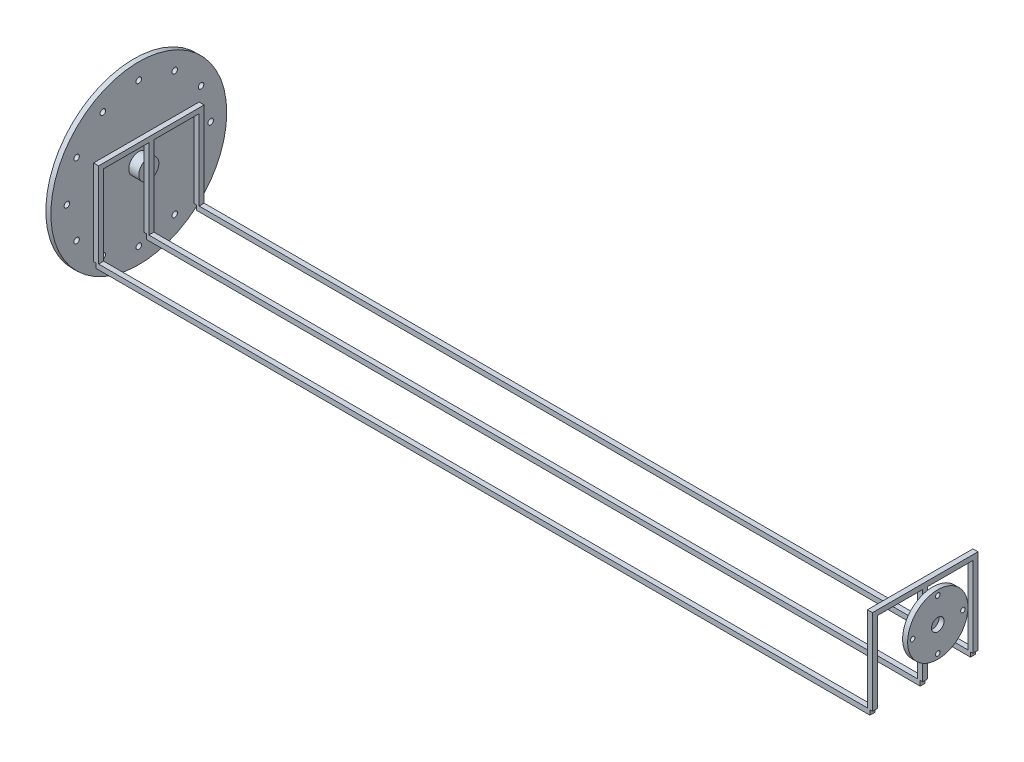
from build123d import *

# Parameters (mm, degrees)
SKETCH_1_R             = 175
SKETCH_1_R_2           = 5.5
EXTRUDE_1_DEPTH        = 10
SKETCH_2_R             = 20
EXTRUDE_2_DEPTH        = 30
EXTRUDE_START          = 20
SKETCH_2_2_R           = 20
EXTRUDE_3_DEPTH        = 20
SKETCH_3_W             = 10
SKETCH_3_H             = 169.24993674
EXTRUDE_1_2_DEPTH      = 10
SKETCH_4_W             = 1540
SKETCH_4_H             = 10
EXTRUDE_2_2_DEPTH      = 10
PATTERN_LINEAR_1_COUNT = 2
PATTERN_LINEAR_1_PITCH = 1540
PATTERN_LINEAR_2_COUNT = 2
PATTERN_LINEAR_2_PITCH = 1560
SKETCH_5_R             = 60
EXTRUDE_4_DEPTH        = 10
CUT_EXTRUDE_2_REACH    = 1640.795
SKETCH_6_R             = 4.5
SKETCH_7_R             = 12.5
CUT_EXTRUDE_3_DEPTH    = 10
SKETCH_8_W             = 200
SKETCH_8_H             = 10
EXTRUDE_3_2_DEPTH      = 10
PATTERN_LINEAR_4_COUNT = 2
PATTERN_LINEAR_4_PITCH = 1540
SKETCH_9_W             = 10
SKETCH_9_H             = 170
EXTRUDE_4_2_DEPTH      = 10
PATTERN_LINEAR_6_COUNT = 2
PATTERN_LINEAR_6_PITCH = 100
PATTERN_LINEAR_7_COUNT = 2
PATTERN_LINEAR_7_PITCH = 1540
SKETCH_10_W            = 10
SKETCH_10_H            = 170
EXTRUDE_5_DEPTH        = 10
PATTERN_LINEAR_8_COUNT = 2
PATTERN_LINEAR_8_PITCH = 100
PATTERN_LINEAR_9_COUNT = 2
PATTERN_LINEAR_9_PITCH = 1540


with BuildPart() as part:
    # 草图1 → Extrude 1 (new body)
    with BuildSketch(Plane(origin=(0, 0, 0), x_dir=(0, 0, -1), z_dir=(1, 0, 0))):
        Circle(SKETCH_1_R)
        with Locations((-143, 0)):
            Circle(SKETCH_1_R_2, mode=Mode.SUBTRACT)
        with Locations((-123.841632741, 71.5)):
            Circle(SKETCH_1_R_2, mode=Mode.SUBTRACT)
        with Locations((-71.5, 123.841632741)):
            Circle(SKETCH_1_R_2, mode=Mode.SUBTRACT)
        with Locations((0, 143)):
            Circle(SKETCH_1_R_2, mode=Mode.SUBTRACT)
        with Locations((71.5, 123.841632741)):
            Circle(SKETCH_1_R_2, mode=Mode.SUBTRACT)
        with Locations((123.841632741, 71.5)):
            Circle(SKETCH_1_R_2, mode=Mode.SUBTRACT)
        with Locations((143, 0)):
            Circle(SKETCH_1_R_2, mode=Mode.SUBTRACT)
        with Locations((123.841632741, -71.5)):
            Circle(SKETCH_1_R_2, mode=Mode.SUBTRACT)
        with Locations((71.5, -123.841632741)):
            Circle(SKETCH_1_R_2, mode=Mode.SUBTRACT)
        with Locations((0, -143)):
            Circle(SKETCH_1_R_2, mode=Mode.SUBTRACT)
        with Locations((-71.5, -123.841632741)):
            Circle(SKETCH_1_R_2, mode=Mode.SUBTRACT)
        with Locations((-123.841632741, -71.5)):
            Circle(SKETCH_1_R_2, mode=Mode.SUBTRACT)
    extrude(amount=EXTRUDE_1_DEPTH)

    # 草图2 → Extrude 2 (add)
    with BuildSketch(Plane(origin=(10, 0, 0), x_dir=(0, 0, -1), z_dir=(1, 0, 0))):
        Circle(SKETCH_2_R)
    extrude(amount=-EXTRUDE_2_DEPTH)

    # 草图2<2> → Extrude 3 (add)
    with BuildSketch(Plane(origin=(10, 0, 0), x_dir=(0, 0, -1), z_dir=(1, 0, 0)).offset(EXTRUDE_START)):
        Circle(SKETCH_2_2_R)
    extrude_3 = extrude(amount=-EXTRUDE_3_DEPTH)

    # 草图3 → Extrude 1 2 (add)
    with BuildSketch(Plane(origin=(30, 0, 0), x_dir=(0, 0, -1), z_dir=(1, 0, 0))):
        with Locations((-5, -19.147397114)):
            Rectangle(SKETCH_3_W, SKETCH_3_H)
    extrude_1_2 = extrude(amount=EXTRUDE_1_2_DEPTH)

    # 草图4 → Extrude 2 2 (add)
    with BuildSketch(Plane.XY):
        with Locations((805, -108.772365484)):
            Rectangle(SKETCH_4_W, SKETCH_4_H)
    extrude_2_2 = extrude(amount=EXTRUDE_2_2_DEPTH)

    # 阵列(线性)1: Extrude 1 2 ×2
    with Locations(*[(i * PATTERN_LINEAR_1_PITCH, 0, 0) for i in range(1, PATTERN_LINEAR_1_COUNT)]):
        add(extrude_1_2)

    # 阵列(线性)2: Extrude 3 ×2
    with Locations(*[(i * PATTERN_LINEAR_2_PITCH, 0, 0) for i in range(1, PATTERN_LINEAR_2_COUNT)]):
        add(extrude_3)

    # 草图5 → Extrude 4 (add)
    with BuildSketch(Plane(origin=(1590, 0, 0), x_dir=(0, 0, -1), z_dir=(1, 0, 0))):
        Circle(SKETCH_5_R)
    extrude(amount=EXTRUDE_4_DEPTH)

    # 草图6 → 切除-拉伸2 (cut, up to next)
    with BuildSketch(Plane(origin=(1600, 0, 0), x_dir=(0, 0, -1), z_dir=(1, 0, 0)), mode=Mode.PRIVATE) as cut_extrude_2_sk1:
        with Locations((0, 50)):
            Circle(SKETCH_6_R)
    cut_extrude_2_tool1 = extrude(cut_extrude_2_sk1.sketch, amount=-CUT_EXTRUDE_2_REACH, mode=Mode.PRIVATE) & part.part
    # 草图6 → 切除-拉伸2 (cut, up to next)
    with BuildSketch(Plane(origin=(1600, 0, 0), x_dir=(0, 0, -1), z_dir=(1, 0, 0)), mode=Mode.PRIVATE) as cut_extrude_2_sk2:
        with Locations((50, 0)):
            Circle(SKETCH_6_R)
    cut_extrude_2_tool2 = extrude(cut_extrude_2_sk2.sketch, amount=-CUT_EXTRUDE_2_REACH, mode=Mode.PRIVATE) & part.part
    # 草图6 → 切除-拉伸2 (cut, up to next)
    with BuildSketch(Plane(origin=(1600, 0, 0), x_dir=(0, 0, -1), z_dir=(1, 0, 0)), mode=Mode.PRIVATE) as cut_extrude_2_sk3:
        with Locations((0, -50)):
            Circle(SKETCH_6_R)
    cut_extrude_2_tool3 = extrude(cut_extrude_2_sk3.sketch, amount=-CUT_EXTRUDE_2_REACH, mode=Mode.PRIVATE) & part.part
    # 草图6 → 切除-拉伸2 (cut, up to next)
    with BuildSketch(Plane(origin=(1600, 0, 0), x_dir=(0, 0, -1), z_dir=(1, 0, 0)), mode=Mode.PRIVATE) as cut_extrude_2_sk4:
        with Locations((-50, 0)):
            Circle(SKETCH_6_R)
    cut_extrude_2_tool4 = extrude(cut_extrude_2_sk4.sketch, amount=-CUT_EXTRUDE_2_REACH, mode=Mode.PRIVATE) & part.part
    add(cut_extrude_2_tool1.solids().sort_by_distance((1600, 50, 0))[0], mode=Mode.SUBTRACT)
    add(cut_extrude_2_tool2.solids().sort_by_distance((1600, 0, -50))[0], mode=Mode.SUBTRACT)
    add(cut_extrude_2_tool3.solids().sort_by_distance((1600, -50, 0))[0], mode=Mode.SUBTRACT)
    add(cut_extrude_2_tool4.solids().sort_by_distance((1600, 0, 50))[0], mode=Mode.SUBTRACT)

    # 草图7 → 切除-拉伸3 (cut)
    with BuildSketch(Plane(origin=(1600, 0, 0), x_dir=(0, 0, -1), z_dir=(1, 0, 0))):
        Circle(SKETCH_7_R)
    extrude(amount=-CUT_EXTRUDE_3_DEPTH, mode=Mode.SUBTRACT)

    # 草图8 → Extrude 3 2 (add)
    with BuildSketch(Plane(origin=(30, 0, 0), x_dir=(0, 0, -1), z_dir=(1, 0, 0))):
        with Locations((0, 60.477571256)):
            Rectangle(SKETCH_8_W, SKETCH_8_H)
    extrude_3_2 = extrude(amount=EXTRUDE_3_2_DEPTH)

    # 阵列(线性)4: Extrude 3 2 ×2
    with Locations(*[(i * PATTERN_LINEAR_4_PITCH, 0, 0) for i in range(1, PATTERN_LINEAR_4_COUNT)]):
        add(extrude_3_2)

    # 草图9 → Extrude 4 2 (add)
    with BuildSketch(Plane(origin=(30, 0, 0), x_dir=(0, 0, -1), z_dir=(1, 0, 0))):
        with Locations((95, -19.522428744)):
            Rectangle(SKETCH_9_W, SKETCH_9_H)
    extrude_4_2 = extrude(amount=EXTRUDE_4_2_DEPTH)

    # 阵列(线性)6: Extrude 2 2 ×2
    with Locations(*[(0, 0, -i * PATTERN_LINEAR_6_PITCH) for i in range(1, PATTERN_LINEAR_6_COUNT)]):
        add(extrude_2_2)

    # 阵列(线性)7: Extrude 4 2 ×2
    with Locations(*[(i * PATTERN_LINEAR_7_PITCH, 0, 0) for i in range(1, PATTERN_LINEAR_7_COUNT)]):
        add(extrude_4_2)

    # 草图10 → 拉伸-薄壁5 (add)
    with BuildSketch(Plane(origin=(30, 0, 0), x_dir=(0, 0, -1), z_dir=(1, 0, 0))):
        with Locations((-105, -19.522428744)):
            Rectangle(SKETCH_10_W, SKETCH_10_H)
    extrude_5 = extrude(amount=EXTRUDE_5_DEPTH)

    # 阵列(线性)8: Extrude 2 2 ×2
    with Locations(*[(0, 0, i * PATTERN_LINEAR_8_PITCH) for i in range(1, PATTERN_LINEAR_8_COUNT)]):
        add(extrude_2_2)

    # 阵列(线性)9: 拉伸-薄壁5 ×2
    with Locations(*[(i * PATTERN_LINEAR_9_PITCH, 0, 0) for i in range(1, PATTERN_LINEAR_9_COUNT)]):
        add(extrude_5)


solid = part.part
